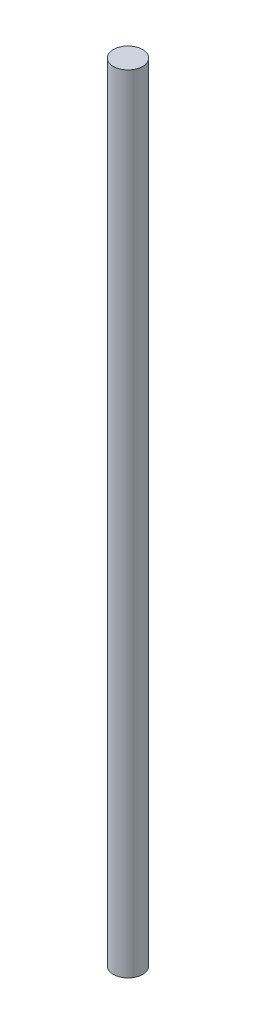
from build123d import *

# Parameters (mm, degrees)
SKETCH1_R           = 1.4224
BOSS_EXTRUDE1_DEPTH = 76.2


with BuildPart() as part:
    # Sketch1 → Boss-Extrude1 (new body)
    with BuildSketch(Plane(origin=(0, 0, 0), x_dir=(1, 0, 0), z_dir=(0, 1, 0))):
        with Locations(Location((0, 0, 0), (0, 0, 90))):
            Circle(SKETCH1_R)
    extrude(amount=BOSS_EXTRUDE1_DEPTH)


solid = part.part
